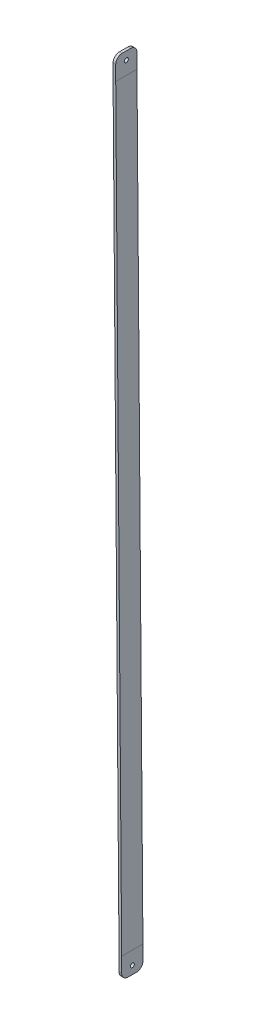
from build123d import *

# Parameters (mm, degrees)
BOSS_EXTRUDE1_DEPTH     = 12.7
FILLET1_R               = 7.62
CUT_EXTRUDE1_DEPTH      = 953.611211641
CUT_EXTRUDE1_DEPTH_BACK = 953.611211641
SKETCH2_R               = 2.413


with BuildPart() as part:
    # Sketch1 → Boss-Extrude1 (new, symmetric)
    with BuildSketch(Plane.XY):
        Polygon((0, 0), (3.175, 0), (3.175, 25.4), (-3.937, 927.1), (-3.937, 952.5), (-7.112, 952.5), (-7.112, 927.1), (0, 25.4), align=None)
    extrude(amount=BOSS_EXTRUDE1_DEPTH, both=True)

    # Fillet1
    fillet1_edges = [part.edges().sort_by_distance(p)[0] for p in [
        (1.5875, 0, -12.7),
        (-5.5245, 952.5, 12.7),
        (1.5875, 0, 12.7),
        (-5.5245, 952.5, -12.7),
    ]]
    fillet(fillet1_edges, radius=FILLET1_R)

    # Sketch2 → Cut-Extrude1 (cut, two sides: drawn at the far end of the back side and taken through both)
    with BuildSketch(Plane(origin=(-3.937, 0, 0), x_dir=(0, 0, -1), z_dir=(1, 0, 0)).offset(-CUT_EXTRUDE1_DEPTH_BACK)):
        with Locations((0, 942.848)):
            Circle(SKETCH2_R)
        with Locations((0, 9.652)):
            Circle(SKETCH2_R)
    extrude(amount=CUT_EXTRUDE1_DEPTH + CUT_EXTRUDE1_DEPTH_BACK, mode=Mode.SUBTRACT)


solid = part.part
